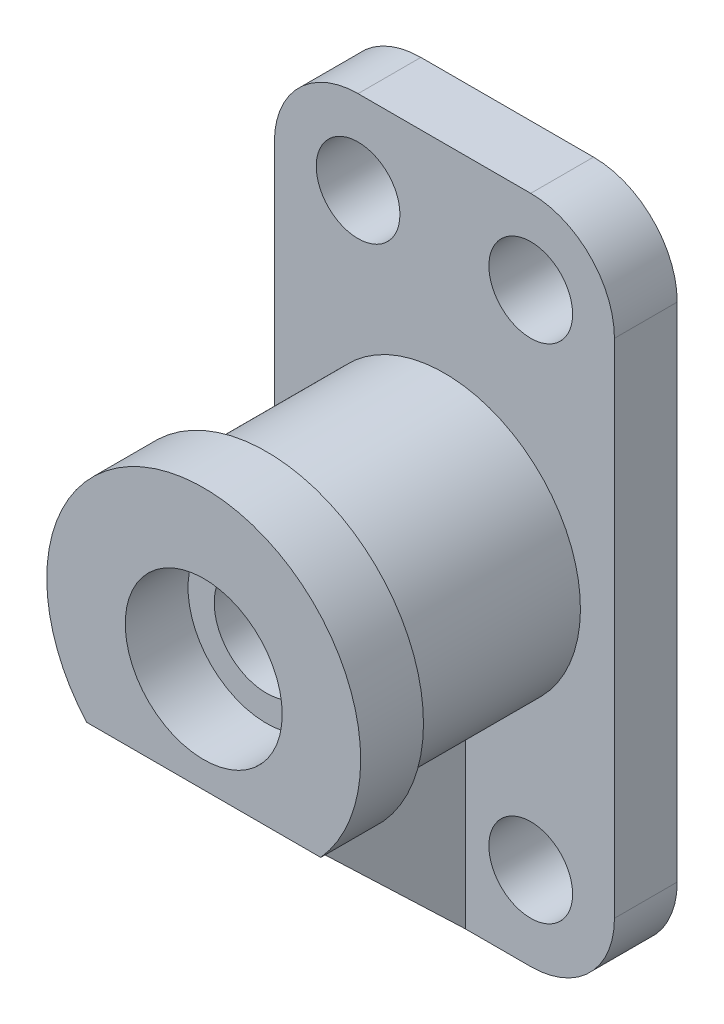
from build123d import *

# Parameters (mm, degrees)
IZIM1_R                     = 8
Y_KSEKLIK_EKSTR_ZYON2_DEPTH = 12
IZIM2_R                     = 26
IZIM2_R_2                   = 10
Y_KSEKLIK_EKSTR_ZYON3_DEPTH = 34
KES_EKSTR_ZYON1_START       = -34
IZIM3_R                     = 10
KES_EKSTR_ZYON1_DEPTH       = 34
IZIM4_R                     = 30
IZIM4_R_2                   = 15
Y_KSEKLIK_EKSTR_ZYON4_DEPTH = 12
IZIM6_W                     = 47.489367516
IZIM6_H                     = 14.251313653
KES_EKSTR_ZYON2_DEPTH       = 46
FEDER1_REACH                = 120.683
IZIM9_WALL_W                = 303.022183262
IZIM9_WALL_H                = 8


with BuildPart() as part:
    # Çizim1 → Yükseklik-Ekstrüzyon2 (new body)
    with BuildSketch(Plane.XY):
        with BuildLine():
            Line((-85.16772712, 82.313308987), (-85.16772712, -13.686691013))
            ThreePointArc((-85.16772712, -13.686691013), (-80.481435619, -25.000399512), (-69.16772712, -29.686691013))
            Line((-69.16772712, -29.686691013), (-36.16772712, -29.686691013))
            ThreePointArc((-36.16772712, -29.686691013), (-24.854018621, -25.000399512), (-20.16772712, -13.686691013))
            Line((-20.16772712, -13.686691013), (-20.16772712, 82.313308987))
            ThreePointArc((-20.16772712, 82.313308987), (-24.854018621, 93.627017486), (-36.16772712, 98.313308987))
            Line((-36.16772712, 98.313308987), (-69.16772712, 98.313308987))
            ThreePointArc((-69.16772712, 98.313308987), (-80.481435619, 93.627017486), (-85.16772712, 82.313308987))
        make_face()
        with Locations((-69.16772712, 82.313308987)):
            Circle(IZIM1_R, mode=Mode.SUBTRACT)
        with Locations((-36.16772712, 82.313308987)):
            Circle(IZIM1_R, mode=Mode.SUBTRACT)
        with Locations((-69.16772712, -13.686691013)):
            Circle(IZIM1_R, mode=Mode.SUBTRACT)
        with Locations((-36.16772712, -13.686691013)):
            Circle(IZIM1_R, mode=Mode.SUBTRACT)
    extrude(amount=Y_KSEKLIK_EKSTR_ZYON2_DEPTH)

    # Çizim2 → Yükseklik-Ekstrüzyon3 (add)
    with BuildSketch(Plane.XY.offset(12)):
        with Locations((-52.66772712, 34.313308987)):
            Circle(IZIM2_R)
        with Locations((-52.66772712, 34.313308987)):
            Circle(IZIM2_R_2, mode=Mode.SUBTRACT)
    extrude(amount=Y_KSEKLIK_EKSTR_ZYON3_DEPTH)

    # Çizim3 → Kes-Ekstrüzyon1 (cut)
    with BuildSketch(Plane.XY.offset(12).offset(KES_EKSTR_ZYON1_START)):
        with Locations((-52.66772712, 34.313308987)):
            Circle(IZIM3_R)
    extrude(amount=KES_EKSTR_ZYON1_DEPTH, mode=Mode.SUBTRACT)

    # Çizim4 → Yükseklik-Ekstrüzyon4 (add)
    with BuildSketch(Plane.XY.offset(46)):
        with Locations((-52.66772712, 34.313308987)):
            Circle(IZIM4_R)
        with Locations((-52.66772712, 34.313308987)):
            Circle(IZIM4_R_2, mode=Mode.SUBTRACT)
    extrude(amount=Y_KSEKLIK_EKSTR_ZYON4_DEPTH)

    # Çizim6 → Kes-Ekstrüzyon2 (cut)
    with BuildSketch(Plane.XY.offset(58)):
        with Locations((-51.283723137, 7.187652161)):
            Rectangle(IZIM6_W, IZIM6_H)
    extrude(amount=-KES_EKSTR_ZYON2_DEPTH, mode=Mode.SUBTRACT)

    # Çizim9 wall → Feder1 (add, up to next)
    with BuildSketch(Plane(origin=(-52.66772712, -7.686691013, 35), x_dir=(0, -0.691222645967, -0.722641857148), z_dir=(0, -0.722641857148, 0.691222645967)), mode=Mode.PRIVATE) as feder1_sk1:
        Rectangle(IZIM9_WALL_W, IZIM9_WALL_H)
    feder1_tool1 = extrude(feder1_sk1.sketch, amount=-FEDER1_REACH, mode=Mode.PRIVATE) - part.part
    add(feder1_tool1.solids().sort_by_distance((-52.66772712, -7.686691013, 35))[0])


solid = part.part
